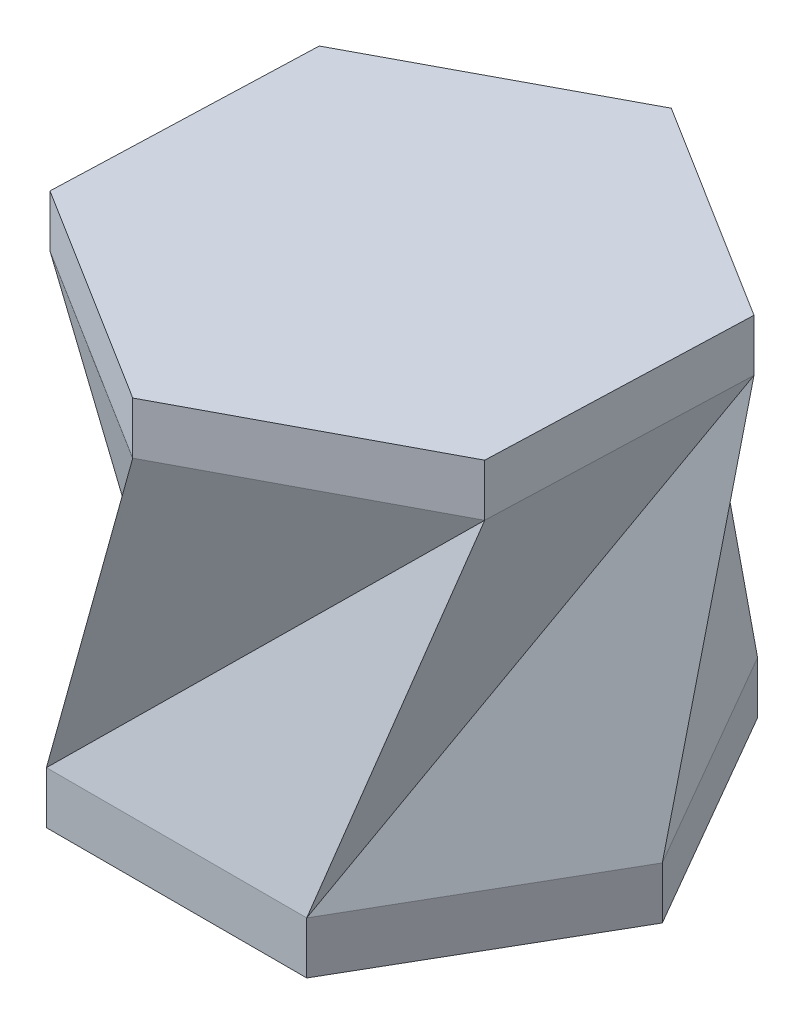
from build123d import *

# Parameters (mm, degrees)
CIRPATTERN2_9_6_ANGLE   = 300
CIRPATTERN2_8_9_ANGLE   = 240
CIRPATTERN2_10_11_ANGLE = 300
CIRPATTERN2_7_13_ANGLE  = 240
CIRPATTERN2_6_15_ANGLE  = 180
CIRPATTERN2_5_17_ANGLE  = 180
CIRPATTERN2_4_19_ANGLE  = 120
CIRPATTERN2_2_21_ANGLE  = 60
CIRPATTERN2_3_23_ANGLE  = 120
CIRPATTERN2_25_ANGLE    = 60
THICKEN1_T2             = 1
BOSS_EXTRUDE1_DEPTH     = 1
BOSS_EXTRUDE2_DEPTH     = 1
SKETCH14_R              = 1
CUT_EXTRUDE1_DEPTH      = 5


with BuildPart() as body_1:
    # Sketch7 → Surface-Plane5: a flat surface bounded by the sketch
    with BuildSketch(Plane(origin=(-3.524717678, 1.028951947, -2.0349967), x_dir=(0.46535585521279793, -0.13573914338570603, -0.8746535388209896), z_dir=(0.8396091564737522, -0.24510260263935496, 0.484748572504189)), mode=Mode.PRIVATE) as surface_plane5_2_region:
        Polygon((2.623971283, -0.700846857), (-2.326779276, -1.400896074), (-5.009045109, 5.141691335), align=None)
    surface_plane5_2 = surface_plane5_2_region.sketch.faces()[0]
    # Sketch2 → Surface-Plane6: a flat surface bounded by the sketch
    with BuildSketch(Plane(origin=(0, 6.644630244, 0), x_dir=(1, 0, 0), z_dir=(0, 1, 0)), mode=Mode.PRIVATE) as surface_plane6_3_region:
        Polygon((-4.239819176, 2.650270431), (-4.415111108, -2.346655898), (-0.175291932, -4.996926329), (4.239819176, -2.650270431), (4.415111108, 2.346655898), (0.175291932, 4.996926329), align=None)
    surface_plane6_3 = surface_plane6_3_region.sketch.faces()[0]
    # Sketch6 → Surface-Plane4: a flat surface bounded by the sketch
    with BuildSketch(Plane(origin=(-2.489523341, -0.629773886, -0.087332357), x_dir=(0.07067634350540625, -0.14247920195053043, -0.9872712552689084), z_dir=(0.968901161979092, 0.24510260263935799, 0.03398900550145962)), mode=Mode.PRIVATE) as surface_plane4_4_region:
        Polygon((4.098319079, 1.265627187), (1.370159284, 7.789210875), (-3.575551438, 7.054401069), align=None)
    surface_plane4_4 = surface_plane4_4_region.sketch.faces()[0]
    # Sketch6 → Surface-Plane4: a flat surface bounded by the sketch
    with BuildSketch(Plane(origin=(-2.489523341, -0.629773886, -0.087332357), x_dir=(0.07067634350540625, -0.14247920195053043, -0.9872712552689084), z_dir=(0.968901161979092, 0.24510260263935799, 0.03398900550145962)), mode=Mode.PRIVATE) as surface_plane4_5_region:
        Polygon((4.098319079, 1.265627187), (1.370159284, 7.789210875), (-3.575551438, 7.054401069), align=None)
    surface_plane4_5 = surface_plane4_5_region.sketch.faces()[0]
    # CirPattern2 9: a copy of that surface (a pattern of surface bodies)
    cirpattern2_9_6 = surface_plane4_5.rotate(Axis((0, 0, 0), (0, 1, 0)), CIRPATTERN2_9_6_ANGLE)
    # Sketch1 → Surface-Plane7: a flat surface bounded by the sketch
    with BuildSketch(Plane(origin=(0, 0, 0), x_dir=(1, 0, 0), z_dir=(0, 1, 0)), mode=Mode.PRIVATE) as surface_plane7_7_region:
        Polygon((5, 0), (2.5, 4.330127019), (-2.5, 4.330127019), (-5, 0), (-2.5, -4.330127019), (2.5, -4.330127019), align=None)
    surface_plane7_7 = surface_plane7_7_region.sketch.faces()[0]
    # Sketch7 → Surface-Plane5: a flat surface bounded by the sketch
    with BuildSketch(Plane(origin=(-3.524717678, 1.028951947, -2.0349967), x_dir=(0.46535585521279793, -0.13573914338570603, -0.8746535388209896), z_dir=(0.8396091564737522, -0.24510260263935496, 0.484748572504189)), mode=Mode.PRIVATE) as surface_plane5_8_region:
        Polygon((2.623971283, -0.700846857), (-2.326779276, -1.400896074), (-5.009045109, 5.141691335), align=None)
    surface_plane5_8 = surface_plane5_8_region.sketch.faces()[0]
    # CirPattern2 8: a copy of that surface (a pattern of surface bodies)
    cirpattern2_8_9 = surface_plane5_8.rotate(Axis((0, 0, 0), (0, 1, 0)), CIRPATTERN2_8_9_ANGLE)
    # Sketch7 → Surface-Plane5: a flat surface bounded by the sketch
    with BuildSketch(Plane(origin=(-3.524717678, 1.028951947, -2.0349967), x_dir=(0.46535585521279793, -0.13573914338570603, -0.8746535388209896), z_dir=(0.8396091564737522, -0.24510260263935496, 0.484748572504189)), mode=Mode.PRIVATE) as surface_plane5_10_region:
        Polygon((2.623971283, -0.700846857), (-2.326779276, -1.400896074), (-5.009045109, 5.141691335), align=None)
    surface_plane5_10 = surface_plane5_10_region.sketch.faces()[0]
    # CirPattern2 10: a copy of that surface (a pattern of surface bodies)
    cirpattern2_10_11 = surface_plane5_10.rotate(Axis((0, 0, 0), (0, 1, 0)), CIRPATTERN2_10_11_ANGLE)
    # Sketch6 → Surface-Plane4: a flat surface bounded by the sketch
    with BuildSketch(Plane(origin=(-2.489523341, -0.629773886, -0.087332357), x_dir=(0.07067634350540625, -0.14247920195053043, -0.9872712552689084), z_dir=(0.968901161979092, 0.24510260263935799, 0.03398900550145962)), mode=Mode.PRIVATE) as surface_plane4_12_region:
        Polygon((4.098319079, 1.265627187), (1.370159284, 7.789210875), (-3.575551438, 7.054401069), align=None)
    surface_plane4_12 = surface_plane4_12_region.sketch.faces()[0]
    # CirPattern2 7: a copy of that surface (a pattern of surface bodies)
    cirpattern2_7_13 = surface_plane4_12.rotate(Axis((0, 0, 0), (0, 1, 0)), CIRPATTERN2_7_13_ANGLE)
    # Sketch7 → Surface-Plane5: a flat surface bounded by the sketch
    with BuildSketch(Plane(origin=(-3.524717678, 1.028951947, -2.0349967), x_dir=(0.46535585521279793, -0.13573914338570603, -0.8746535388209896), z_dir=(0.8396091564737522, -0.24510260263935496, 0.484748572504189)), mode=Mode.PRIVATE) as surface_plane5_14_region:
        Polygon((2.623971283, -0.700846857), (-2.326779276, -1.400896074), (-5.009045109, 5.141691335), align=None)
    surface_plane5_14 = surface_plane5_14_region.sketch.faces()[0]
    # CirPattern2 6: a copy of that surface (a pattern of surface bodies)
    cirpattern2_6_15 = surface_plane5_14.rotate(Axis((0, 0, 0), (0, 1, 0)), CIRPATTERN2_6_15_ANGLE)
    # Sketch6 → Surface-Plane4: a flat surface bounded by the sketch
    with BuildSketch(Plane(origin=(-2.489523341, -0.629773886, -0.087332357), x_dir=(0.07067634350540625, -0.14247920195053043, -0.9872712552689084), z_dir=(0.968901161979092, 0.24510260263935799, 0.03398900550145962)), mode=Mode.PRIVATE) as surface_plane4_16_region:
        Polygon((4.098319079, 1.265627187), (1.370159284, 7.789210875), (-3.575551438, 7.054401069), align=None)
    surface_plane4_16 = surface_plane4_16_region.sketch.faces()[0]
    # CirPattern2 5: a copy of that surface (a pattern of surface bodies)
    cirpattern2_5_17 = surface_plane4_16.rotate(Axis((0, 0, 0), (0, 1, 0)), CIRPATTERN2_5_17_ANGLE)
    # Sketch7 → Surface-Plane5: a flat surface bounded by the sketch
    with BuildSketch(Plane(origin=(-3.524717678, 1.028951947, -2.0349967), x_dir=(0.46535585521279793, -0.13573914338570603, -0.8746535388209896), z_dir=(0.8396091564737522, -0.24510260263935496, 0.484748572504189)), mode=Mode.PRIVATE) as surface_plane5_18_region:
        Polygon((2.623971283, -0.700846857), (-2.326779276, -1.400896074), (-5.009045109, 5.141691335), align=None)
    surface_plane5_18 = surface_plane5_18_region.sketch.faces()[0]
    # CirPattern2 4: a copy of that surface (a pattern of surface bodies)
    cirpattern2_4_19 = surface_plane5_18.rotate(Axis((0, 0, 0), (0, 1, 0)), CIRPATTERN2_4_19_ANGLE)
    # Sketch7 → Surface-Plane5: a flat surface bounded by the sketch
    with BuildSketch(Plane(origin=(-3.524717678, 1.028951947, -2.0349967), x_dir=(0.46535585521279793, -0.13573914338570603, -0.8746535388209896), z_dir=(0.8396091564737522, -0.24510260263935496, 0.484748572504189)), mode=Mode.PRIVATE) as surface_plane5_20_region:
        Polygon((2.623971283, -0.700846857), (-2.326779276, -1.400896074), (-5.009045109, 5.141691335), align=None)
    surface_plane5_20 = surface_plane5_20_region.sketch.faces()[0]
    # CirPattern2 2: a copy of that surface (a pattern of surface bodies)
    cirpattern2_2_21 = surface_plane5_20.rotate(Axis((0, 0, 0), (0, 1, 0)), CIRPATTERN2_2_21_ANGLE)
    # Sketch6 → Surface-Plane4: a flat surface bounded by the sketch
    with BuildSketch(Plane(origin=(-2.489523341, -0.629773886, -0.087332357), x_dir=(0.07067634350540625, -0.14247920195053043, -0.9872712552689084), z_dir=(0.968901161979092, 0.24510260263935799, 0.03398900550145962)), mode=Mode.PRIVATE) as surface_plane4_22_region:
        Polygon((4.098319079, 1.265627187), (1.370159284, 7.789210875), (-3.575551438, 7.054401069), align=None)
    surface_plane4_22 = surface_plane4_22_region.sketch.faces()[0]
    # CirPattern2 3: a copy of that surface (a pattern of surface bodies)
    cirpattern2_3_23 = surface_plane4_22.rotate(Axis((0, 0, 0), (0, 1, 0)), CIRPATTERN2_3_23_ANGLE)
    # Sketch6 → Surface-Plane4: a flat surface bounded by the sketch
    with BuildSketch(Plane(origin=(-2.489523341, -0.629773886, -0.087332357), x_dir=(0.07067634350540625, -0.14247920195053043, -0.9872712552689084), z_dir=(0.968901161979092, 0.24510260263935799, 0.03398900550145962)), mode=Mode.PRIVATE) as surface_plane4_24_region:
        Polygon((4.098319079, 1.265627187), (1.370159284, 7.789210875), (-3.575551438, 7.054401069), align=None)
    surface_plane4_24 = surface_plane4_24_region.sketch.faces()[0]
    # CirPattern2: a copy of that surface (a pattern of surface bodies)
    cirpattern2_25 = surface_plane4_24.rotate(Axis((0, 0, 0), (0, 1, 0)), CIRPATTERN2_25_ANGLE)
    # Surface-Knit1: the surfaces knitted into one
    surface_knit1_1 = Shell(Face.sew_faces(surface_plane5_2.faces() + surface_plane6_3.faces() + surface_plane4_4.faces() + cirpattern2_9_6.faces() + surface_plane7_7.faces() + cirpattern2_8_9.faces() + cirpattern2_10_11.faces() + cirpattern2_7_13.faces() + cirpattern2_6_15.faces() + cirpattern2_5_17.faces() + cirpattern2_4_19.faces() + cirpattern2_2_21.faces() + cirpattern2_3_23.faces() + cirpattern2_25.faces())[0])
    add(Solid.thicken(surface_knit1_1, -THICKEN1_T2))

    # Sketch12 → Boss-Extrude1 (add)
    with BuildSketch(Plane(origin=(0, 6.644630244, 0), x_dir=(1, 0, 0), z_dir=(0, 1, 0))):
        Polygon((0.175291932, 4.996926329), (-4.239819176, 2.650270431), (-4.415111108, -2.346655898), (-0.175291932, -4.996926329), (4.239819176, -2.650270431), (4.415111108, 2.346655898), align=None)
    extrude(amount=BOSS_EXTRUDE1_DEPTH)

    # Sketch13 → Boss-Extrude2 (add)
    with BuildSketch(Plane.XZ):
        Polygon((5, 0), (2.5, 4.330127019), (-2.5, 4.330127019), (-5, 0), (-2.5, -4.330127019), (2.5, -4.330127019), align=None)
    extrude(amount=BOSS_EXTRUDE2_DEPTH)

    # Sketch14 → Cut-Extrude1 (cut)
    with BuildSketch(Plane.XZ.offset(1)):
        with Locations(Location((0, 0, 0), (0, 0, 270))):
            Circle(SKETCH14_R)
    extrude(amount=-CUT_EXTRUDE1_DEPTH, mode=Mode.SUBTRACT)


solid = body_1.part
